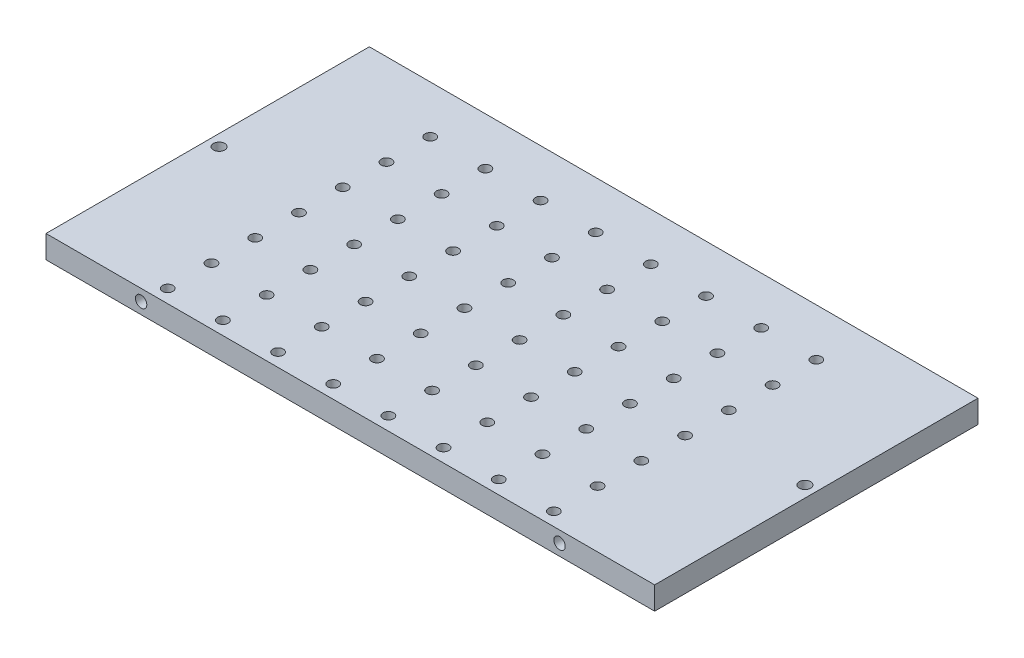
from build123d import *

# Parameters (mm, degrees)
ESQUISSE1_W                     = 160
ESQUISSE1_H                     = 85
BOSS_EXTRU_1_DEPTH              = 6
ESQUISSE2_R                     = 1.5
ENL_V_MAT_EXTRU_1_DEPTH         = 85
ESQUISSE3_R                     = 1.375
ENL_V_MAT_EXTRU_2_DEPTH         = 6
R_P_TITION_LIN_AIRE1_COUNT      = 7
R_P_TITION_LIN_AIRE1_PITCH      = 11.5
R_P_TITION_LIN_AIRE1_COUNT_DIR2 = 8
R_P_TITION_LIN_AIRE1_PITCH_DIR2 = 14.5
ESQUISSE4_R                     = 1.5
ENL_V_MAT_EXTRU_3_DEPTH         = 6


with BuildPart() as part:
    # Esquisse1 → Boss.-Extru.1 (new body)
    with BuildSketch(Plane(origin=(0, 0, 0), x_dir=(1, 0, 0), z_dir=(0, 1, 0))):
        Rectangle(ESQUISSE1_W, ESQUISSE1_H)
    extrude(amount=BOSS_EXTRU_1_DEPTH)

    # Esquisse2 → Enlèv. mat.-Extru.1 (cut)
    with BuildSketch(Plane.XY.offset(42.5)):
        with Locations((-55, 3)):
            Circle(ESQUISSE2_R)
        with Locations((55, 3)):
            Circle(ESQUISSE2_R)
    extrude(amount=-ENL_V_MAT_EXTRU_1_DEPTH, mode=Mode.SUBTRACT)

    # Esquisse3 → Enlèv. mat.-Extru.2 (cut)
    with BuildSketch(Plane(origin=(0, 0, 0), x_dir=(1, 0, 0), z_dir=(0, 1, 0))):
        with Locations(Location((-51.5, 30, 0), (0, 0, 90))):
            Circle(ESQUISSE3_R)
    enl_v_mat_extru_2 = extrude(amount=ENL_V_MAT_EXTRU_2_DEPTH, mode=Mode.SUBTRACT)

    # Répétition linéaire1: Enl_v. mat.-Extru.2 7 × 8
    with Locations(*[(j * R_P_TITION_LIN_AIRE1_PITCH_DIR2, 0, i * R_P_TITION_LIN_AIRE1_PITCH) for i in range(R_P_TITION_LIN_AIRE1_COUNT) for j in range(R_P_TITION_LIN_AIRE1_COUNT_DIR2) if (i, j) != (0, 0)]):
        add(enl_v_mat_extru_2, mode=Mode.SUBTRACT)

    # Esquisse4 → Enlèv. mat.-Extru.3 (cut)
    with BuildSketch(Plane(origin=(0, 0, 0), x_dir=(1, 0, 0), z_dir=(0, 1, 0))):
        with Locations(Location((-77, 0, 0), (0, 0, 90))):
            Circle(ESQUISSE4_R)
        with Locations(Location((77, 0, 0), (0, 0, 90))):
            Circle(ESQUISSE4_R)
    extrude(amount=ENL_V_MAT_EXTRU_3_DEPTH, mode=Mode.SUBTRACT)


solid = part.part
